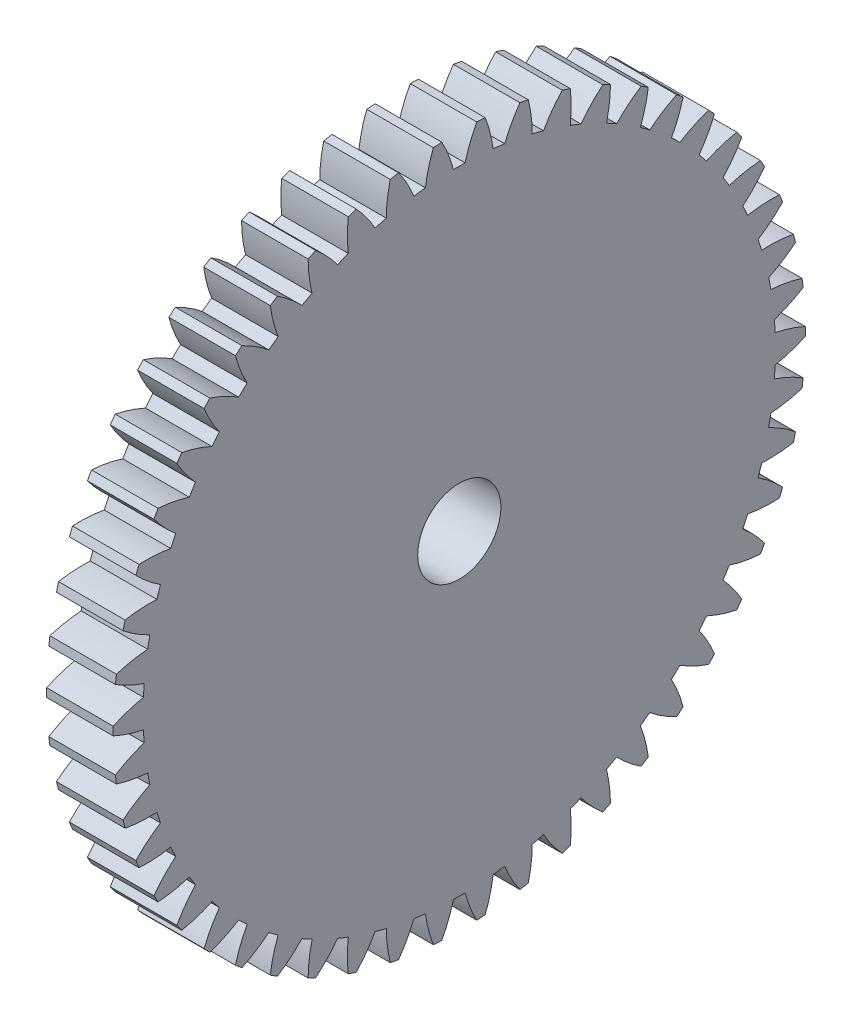
from build123d import *

# Parameters (mm, degrees)
BASPROSKE_W     = 4
BASPROSKE_H     = 20.8
TOOTHCUT_DEPTH  = 30.686360504
TEETHCUTS_COUNT = 50
TEETHCUTS_ANGLE = 352.8
BORSKE_R        = 2.5
BORE_DEPTH      = 50.0000508


with BuildPart() as part:
    # BasProSke → Base-Revolve (revolve)
    with BuildSketch(Plane(origin=(0, 0, 0), x_dir=(1, 0, 0), z_dir=(0, 1, 0)), mode=Mode.PRIVATE) as base_revolve_sk:
        with Locations((2, 10.4)):
            Rectangle(BASPROSKE_W, BASPROSKE_H)
    revolve(base_revolve_sk.sketch.rotate(Axis((-10, 0, 0), (1, 0, 0)), 180), axis=Axis((-10, 0, 0), (1, 0, 0)))

    # TooCutSke → ToothCut (cut, through all)
    with BuildSketch(Plane(origin=(0, 0, 0), x_dir=(0, 0, -1), z_dir=(1, 0, 0))):
        with BuildLine():
            ThreePointArc((0.349413338, 18.995786673), (0, 18.999), (-0.349413338, 18.995786673))
            ThreePointArc((-0.349413338, 18.995786673), (-0.652647392, 19.918735641), (-1.065517852, 20.798123879))
            ThreePointArc((-1.065517852, 20.798123879), (0, 20.8254), (1.065517852, 20.798123879))
            ThreePointArc((1.065517852, 20.798123879), (0.652647392, 19.918735641), (0.349413338, 18.995786673))
        make_face()
    toothcut = extrude(amount=TOOTHCUT_DEPTH, mode=Mode.SUBTRACT)

    # TeethCuts: ToothCut ×50 about axis
    teethcuts_axis = Axis((-10, 0, 0), (1, 0, 0))
    for i in range(1, TEETHCUTS_COUNT):
        add(toothcut.rotate(teethcuts_axis, i * TEETHCUTS_ANGLE / (TEETHCUTS_COUNT - 1)), mode=Mode.SUBTRACT)

    # BorSke → Bore (cut, symmetric)
    with BuildSketch(Plane(origin=(0, 0, 0), x_dir=(0, 0, -1), z_dir=(1, 0, 0))):
        with Locations(Location((0, 0, 0), (0, 0, 180))):
            Circle(BORSKE_R)
    extrude(amount=BORE_DEPTH, both=True, mode=Mode.SUBTRACT)


solid = part.part
